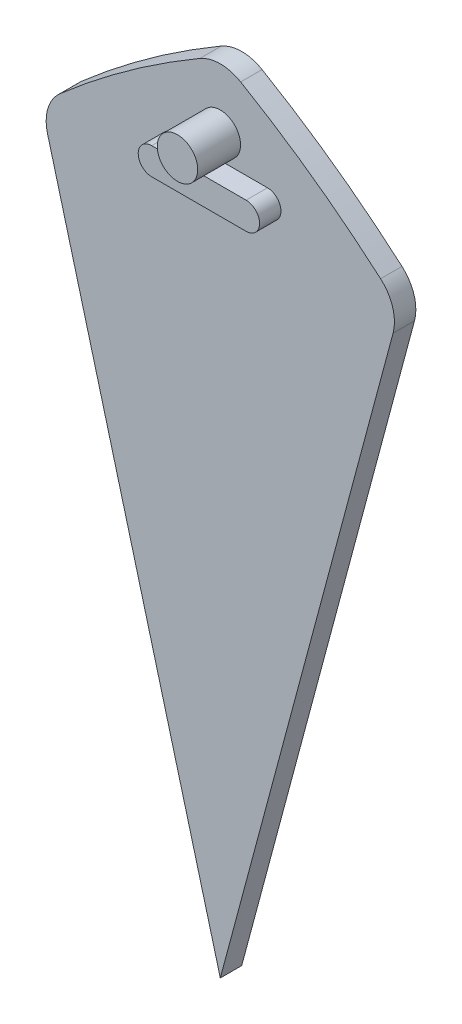
from build123d import *

# Parameters (mm, degrees)
BOSS_EXTRUDE1_DEPTH = 3.175
CUT_EXTRUDE2_START  = -3.175
CUT_EXTRUDE2_DEPTH  = 3.175
FILLET1_R           = 6
BOSS_EXTRUDE2_DEPTH = 3.175
SKETCH2_R           = 3
BOSS_EXTRUDE3_DEPTH = 6.35


with BuildPart() as part:
    # Sketch1 → Boss-Extrude1 (new body)
    with BuildSketch(Plane.XY):
        with BuildLine():
            Line((-32.352380638, 120.740728286), (0, 0))
            Line((0, 0), (0, 125))
            ThreePointArc((0, 125), (-16.315774028, 123.930607672), (-32.352380638, 120.740728286))
        make_face()
        with BuildLine():
            Line((0, 125), (0, 0))
            Line((0, 0), (32.352380638, 120.740728286))
            ThreePointArc((32.352380638, 120.740728286), (16.315774028, 123.930607672), (0, 125))
        make_face()
    extrude(amount=BOSS_EXTRUDE1_DEPTH)

    # Sketch3 → Cut-Extrude2 (cut)
    with BuildSketch(Plane.XY.offset(3.175).offset(CUT_EXTRUDE2_START)):
        with BuildLine():
            ThreePointArc((-12.5, 124.373429638), (-199.821294039, -6.943966706), (0, -118.321595662))
            ThreePointArc((0, -118.321595662), (-69.003341725, -16.373894052), (-26.577702514, 99.189336132))
            Line((-26.577702514, 99.189336132), (-32.352380638, 120.740728286))
            ThreePointArc((-32.352380638, 120.740728286), (-22.499625375, 122.958394825), (-12.5, 124.373429638))
        make_face()
        with BuildLine():
            ThreePointArc((-26.577702514, 99.189336132), (-13.871129508, 109.564341508), (0, 118.321595662))
            ThreePointArc((0, 118.321595662), (-6.172126729, 121.50835908), (-12.5, 124.373429638))
            ThreePointArc((-12.5, 124.373429638), (-22.499625375, 122.958394825), (-32.352380638, 120.740728286))
            Line((-32.352380638, 120.740728286), (-26.577702514, 99.189336132))
        make_face()
        with BuildLine():
            ThreePointArc((-12.5, 124.373429638), (-6.172126729, 121.50835908), (0, 118.321595662))
            ThreePointArc((0, 118.321595662), (6.172126729, 121.50835908), (12.5, 124.373429638))
            ThreePointArc((12.5, 124.373429638), (0, 125), (-12.5, 124.373429638))
        make_face()
        with BuildLine():
            ThreePointArc((26.577702514, 99.189336132), (58.668892288, 54.138757654), (70, 0))
            ThreePointArc((70, 0), (51.189500386, -68.738635424), (0, -118.321595662))
            ThreePointArc((0, -118.321595662), (133.738635424, -116.189500386), (200, 0))
            ThreePointArc((200, 0), (139.624057783, 112.5), (12.5, 124.373429638))
            ThreePointArc((12.5, 124.373429638), (22.499625375, 122.958394825), (32.352380638, 120.740728286))
            Line((32.352380638, 120.740728286), (26.577702514, 99.189336132))
        make_face()
        with BuildLine():
            ThreePointArc((0, 118.321595662), (13.871129508, 109.564341508), (26.577702514, 99.189336132))
            Line((26.577702514, 99.189336132), (32.352380638, 120.740728286))
            ThreePointArc((32.352380638, 120.740728286), (22.499625375, 122.958394825), (12.5, 124.373429638))
            ThreePointArc((12.5, 124.373429638), (6.172126729, 121.50835908), (0, 118.321595662))
        make_face()
    extrude(amount=CUT_EXTRUDE2_DEPTH, mode=Mode.SUBTRACT)

    # Fillet1
    fillet1_edges = [part.edges().sort_by_distance(p)[0] for p in [
        (0, 118.321595662, 1.5875),
        (-26.577702514, 99.189336132, 1.5875),
        (26.577702514, 99.189336132, 1.5875),
    ]]
    fillet(fillet1_edges, radius=FILLET1_R)

    # Sketch4 → Boss-Extrude2 (add)
    with BuildSketch(Plane.XY.offset(3.175)):
        with BuildLine():
            Line((7, 101), (-7, 101))
            ThreePointArc((-7, 101), (-9, 103), (-7, 105))
            Line((-7, 105), (7, 105))
            ThreePointArc((7, 105), (9, 103), (7, 101))
        make_face()
    extrude(amount=BOSS_EXTRUDE2_DEPTH)

    # Sketch2 → Boss-Extrude3 (add)
    with BuildSketch(Plane.XY.offset(3.175)):
        with Locations((0, 108.5)):
            Circle(SKETCH2_R)
    extrude(amount=BOSS_EXTRUDE3_DEPTH)


solid = part.part
